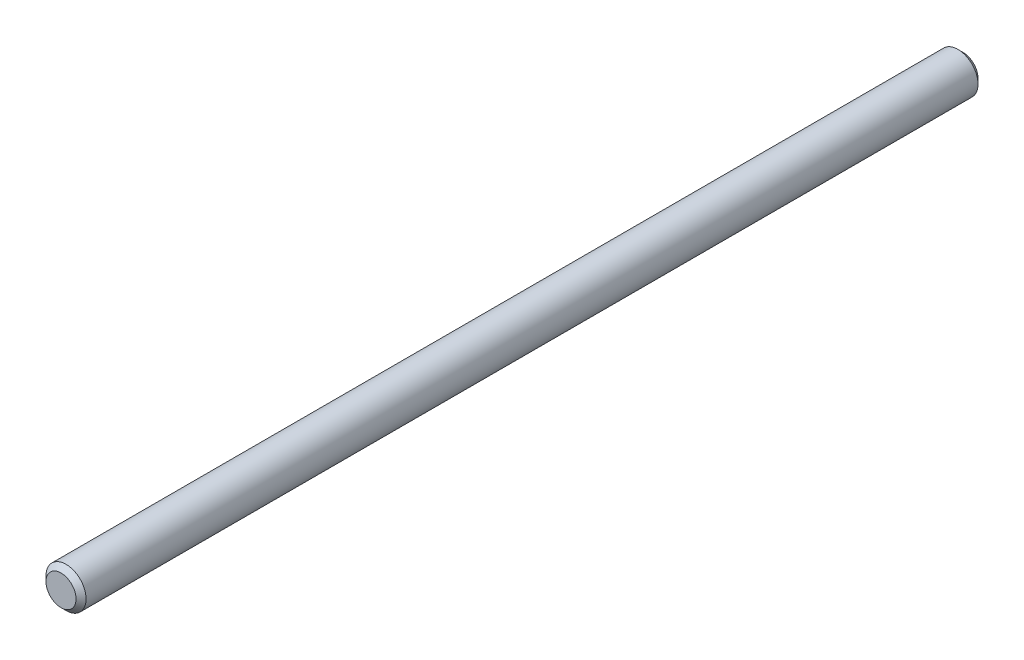
from build123d import *

# Parameters (mm, degrees)
SKETCH_1_R      = 2
EXTRUDE_1_DEPTH = 90
CHAMFER_1_SIZE  = 0.5


with BuildPart() as part:
    # 草图1 → 凸台-拉伸1 (new body)
    with BuildSketch(Plane.XY):
        Circle(SKETCH_1_R)
    extrude(amount=-EXTRUDE_1_DEPTH)

    # 倒角1
    chamfer_1_edges = [part.edges().sort_by_distance(p)[0] for p in [
        (-2, 0, 0),
        (-2, 0, -90),
    ]]
    chamfer(chamfer_1_edges, length=CHAMFER_1_SIZE)


solid = part.part
